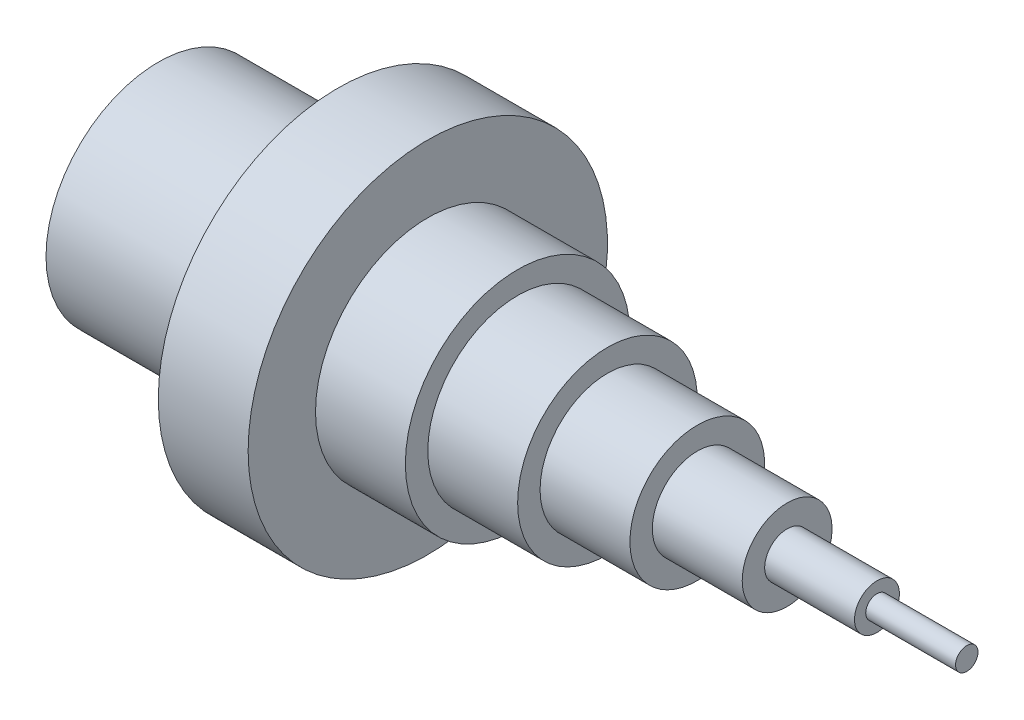
from build123d import *

# Parameters (mm, degrees)
CORTAR_EXTRUIR1_START = -40
CROQUIS2_R            = 20
CORTAR_EXTRUIR1_DEPTH = 40


with BuildPart() as part:
    # Croquis1 → Revolución1 (revolve)
    with BuildSketch(Plane.XY, mode=Mode.PRIVATE) as revoluci_n1_sk:
        Polygon((0, 0), (0, 25), (40, 25), (40, 40), (60, 40), (60, 25), (80, 25), (80, 20), (100, 20), (100, 15), (120, 15), (120, 10), (140, 10), (140, 5), (160, 5), (160, 2.5), (180, 2.5), (180, 0), align=None)
    revolve(revoluci_n1_sk.sketch.rotate(Axis((0, 0, 0), (1, 0, 0)), 90), axis=Axis((0, 0, 0), (1, 0, 0)))

    # Croquis2 → Cortar-Extruir1 (cut)
    with BuildSketch(Plane.ZY.offset(CORTAR_EXTRUIR1_START)):
        Circle(CROQUIS2_R)
    extrude(amount=CORTAR_EXTRUIR1_DEPTH, mode=Mode.SUBTRACT)


solid = part.part
